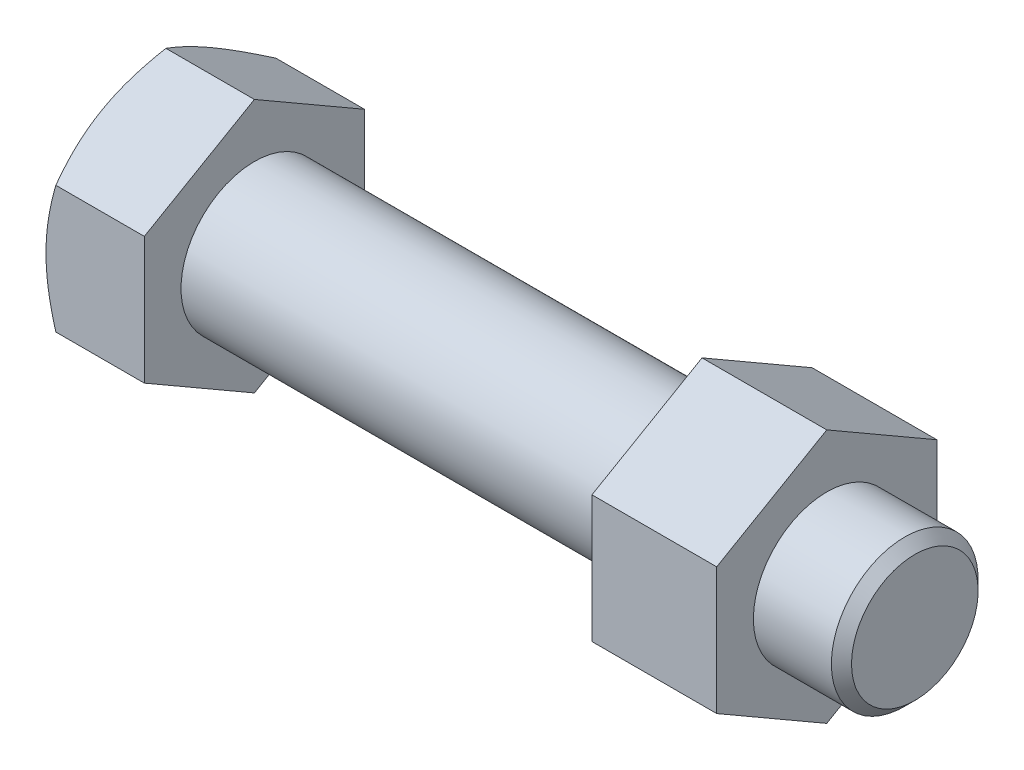
from build123d import *

# Parameters (mm, degrees)
BASEHEAD_DEPTH      = 13.4
BOSS_EXTRUDE1_DEPTH = 17


with BuildPart() as part:
    # Sketch1 → BaseHead (new body)
    with BuildSketch(Plane(origin=(0, 0, 0), x_dir=(0, 0, -1), z_dir=(1, 0, 0))):
        Polygon((15, 8.660254038), (15, -8.660254038), (0, -17.320508076), (-15, -8.660254038), (-15, 8.660254038), (0, 17.320508076), align=None)
    extrude(amount=BASEHEAD_DEPTH)

    # BodySke → BaseBody (revolve)
    with BuildSketch(Plane.XY, mode=Mode.PRIVATE) as basebody_sk:
        Polygon((0, 0), (103.4, 0), (103.4, 8.626), (102.026, 10), (0, 10), align=None)
    revolve(basebody_sk.sketch.rotate(Axis((0, 0, 0), (1, 0, 0)), 90), axis=Axis((0, 0, 0), (1, 0, 0)))

    # Sketch3 → HeadChamfer (revolve, cut)
    with BuildSketch(Plane.XY):
        Polygon((0, 15), (4.226497308, 22.320508076), (4.226497308, 27.320508076), (-10, 27.320508076), (-10, 15), align=None)
    revolve(axis=Axis((0, 0, 0), (1, 0, 0)), mode=Mode.SUBTRACT)

    # Sketch4 → Boss-Extrude1 (add)
    with BuildSketch(Plane(origin=(74.4, 0, 0), x_dir=(0, 0, -1), z_dir=(1, 0, 0))):
        Polygon((0, 17.320508076), (-15, 8.660254038), (-15, -8.660254038), (0, -17.320508076), (15, -8.660254038), (15, 8.660254038), align=None)
    extrude(amount=BOSS_EXTRUDE1_DEPTH)


solid = part.part
